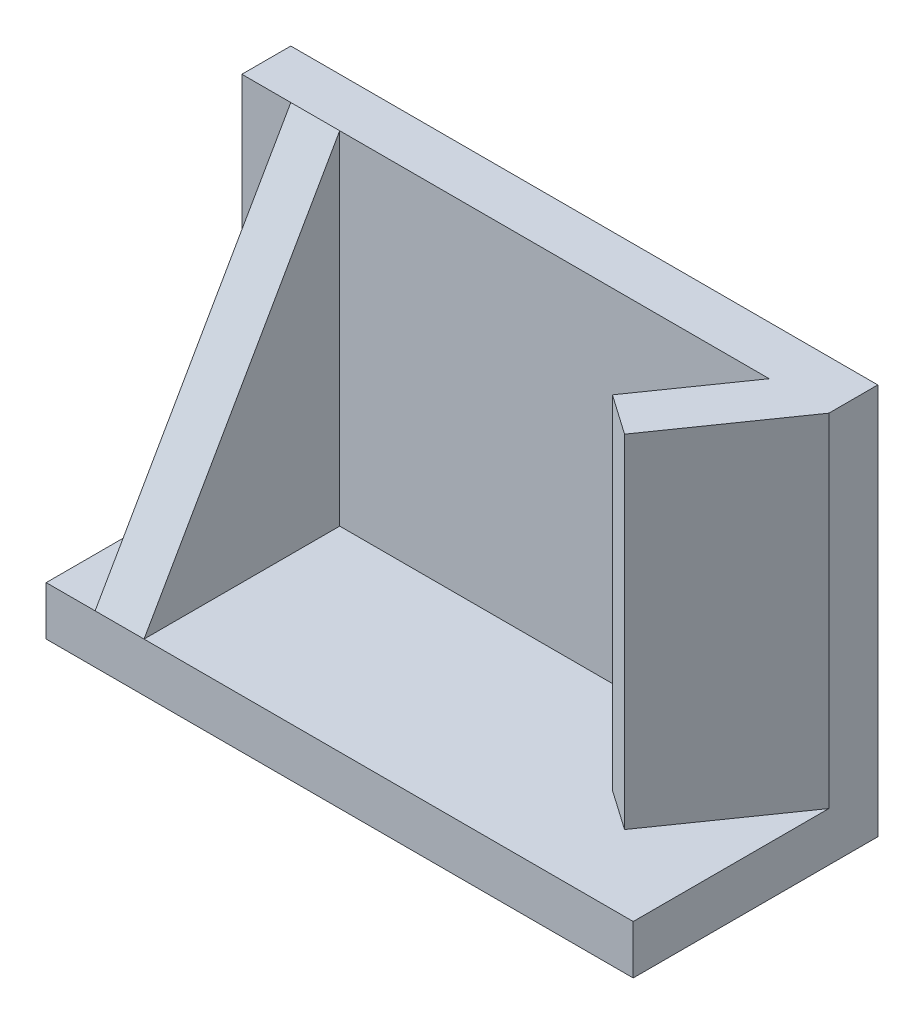
from build123d import *

# Parameters (mm, degrees)
EXTRUDE_1_DEPTH = 120
EXTRUDE_2_REACH = 151.666
EXTRUDE_3_DEPTH = 10


with BuildPart() as part:
    # 草圖1 → 填料-伸長1 (new body)
    with BuildSketch(Plane(origin=(0, 0, 0), x_dir=(0, 0, -1), z_dir=(1, 0, 0))):
        Polygon((-40, 0), (0, 0), (0, 70), (10, 70), (10, -10), (-40, -10), align=None)
    extrude(amount=EXTRUDE_1_DEPTH)

    # 草圖2 → 填料-伸長2 (add, up to next)
    with BuildSketch(Plane(origin=(0, 70, 0), x_dir=(1, 0, 0), z_dir=(0, 1, 0)), mode=Mode.PRIVATE) as extrude_2_sk1:
        Polygon((120, 0), (102.834521938, -24.603787572), (94.633259414, -18.881961552), (107.806755398, 0), align=None)
    extrude_2_tool1 = extrude(extrude_2_sk1.sketch, amount=-EXTRUDE_2_REACH, mode=Mode.PRIVATE) - part.part
    add(extrude_2_tool1.solids().sort_by_distance((106.542259, 70, 10.934177))[0])

    # 草圖3 → 填料-伸長3 (add)
    with BuildSketch(Plane(origin=(10, 0, 0), x_dir=(0, 0, -1), z_dir=(1, 0, 0))):
        Polygon((0, 70), (0, 0), (-40, 0), align=None)
    extrude(amount=EXTRUDE_3_DEPTH)


solid = part.part
